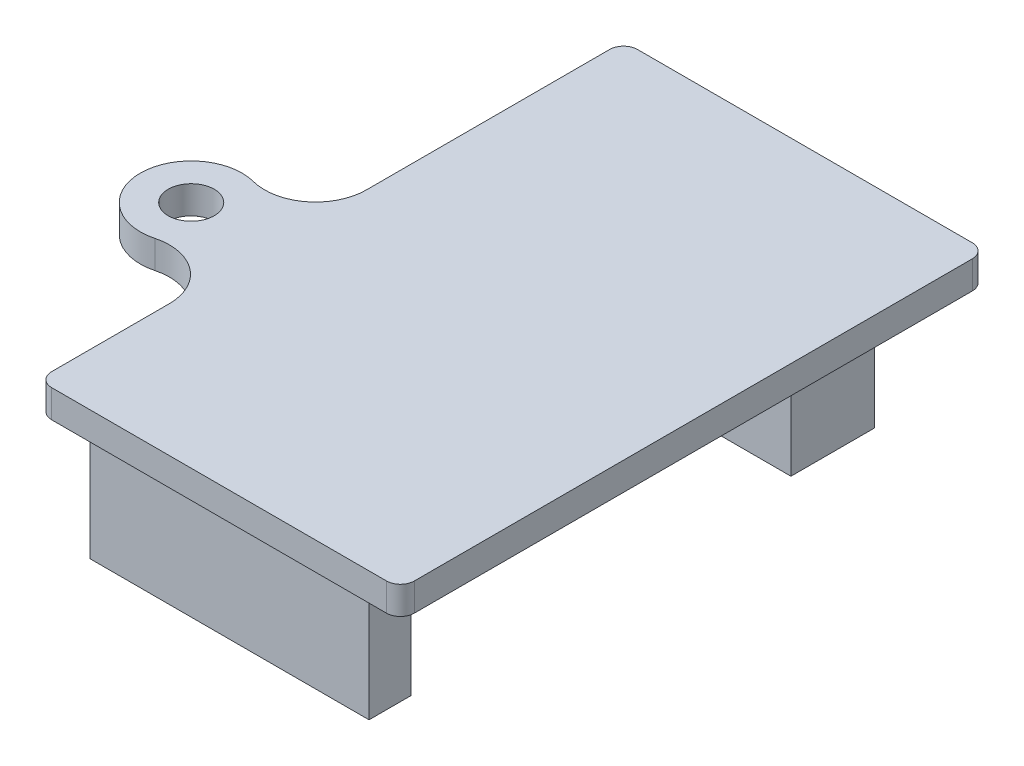
from build123d import *

# Parameters (mm, degrees)
SKETCH1_R           = 1.65
BOSS_EXTRUDE1_DEPTH = 2
SKETCH3_W           = 18
SKETCH3_H           = 12
BOSS_EXTRUDE3_DEPTH = 2
SKETCH3_3_W         = 20
SKETCH3_3_H         = 3
SKETCH3_3_H_2       = 6
BOSS_EXTRUDE4_DEPTH = 9.5
FILLET1_R           = 1
FILLET2_R           = 3
FILLET3_R           = 1


with BuildPart() as part:
    # Sketch1 → Boss-Extrude1 (new body)
    with BuildSketch(Plane(origin=(0, 0, 0), x_dir=(1, 0, 0), z_dir=(0, 1, 0))):
        with BuildLine():
            Line((-26, 42), (0, 42))
            Line((0, 42), (0, 0))
            Line((0, 0), (-26, 0))
            Line((-26, 0), (-26, 9.438307568))
            ThreePointArc((-26, 9.438307568), (-27.419949552, 12.327836077), (-30.575, 12.969153784))
            ThreePointArc((-30.575, 12.969153784), (-35.15, 16.5), (-30.575, 20.030846216))
            ThreePointArc((-30.575, 20.030846216), (-27.419949552, 20.672163923), (-26, 23.561692432))
            Line((-26, 23.561692432), (-26, 42))
        make_face()
        with Locations(Location((-31.5, 16.5, 0), (0, 0, 270))):
            Circle(SKETCH1_R, mode=Mode.SUBTRACT)
    extrude(amount=BOSS_EXTRUDE1_DEPTH)

    # Sketch3 → Boss-Extrude3 (add)
    with BuildSketch(Plane(origin=(0, 0, 0), x_dir=(1, 0, 0), z_dir=(0, 1, 0))):
        with Locations((-15, 16.5)):
            Rectangle(SKETCH3_W, SKETCH3_H)
    extrude(amount=-BOSS_EXTRUDE3_DEPTH)

    # Sketch3<3> → Boss-Extrude4 (add)
    with BuildSketch(Plane(origin=(0, 0, 0), x_dir=(1, 0, 0), z_dir=(0, 1, 0))):
        with Locations((-14.5, 3.75)):
            Rectangle(SKETCH3_3_W, SKETCH3_3_H)
        with Locations((-14.5, 35.5)):
            Rectangle(SKETCH3_3_W, SKETCH3_3_H_2)
    extrude(amount=-BOSS_EXTRUDE4_DEPTH)

    # Fillet1
    fillet1_edges = [part.edges().sort_by_distance(p)[0] for p in [
        (-24.5, 0, -3.75),
        (-4.5, 0, -3.75),
        (-14.5, 0, -2.25),
        (-14.5, 0, -38.5),
        (-4.5, 0, -35.5),
        (-24.5, 0, -35.5),
    ]]
    fillet(fillet1_edges, radius=FILLET1_R)

    # Fillet2
    fillet2_edges = [part.edges().sort_by_distance(p)[0] for p in [
        (-6, -1, -10.5),
        (-24, -1, -10.5),
        (-24, -1, -22.5),
        (-6, -1, -22.5),
    ]]
    fillet(fillet2_edges, radius=FILLET2_R)

    # Fillet3
    fillet3_edges = [part.edges().sort_by_distance(p)[0] for p in [
        (-26, 1, -42),
        (0, 1, -42),
        (0, 1, 0),
        (-26, 1, 0),
    ]]
    fillet(fillet3_edges, radius=FILLET3_R)


solid = part.part
